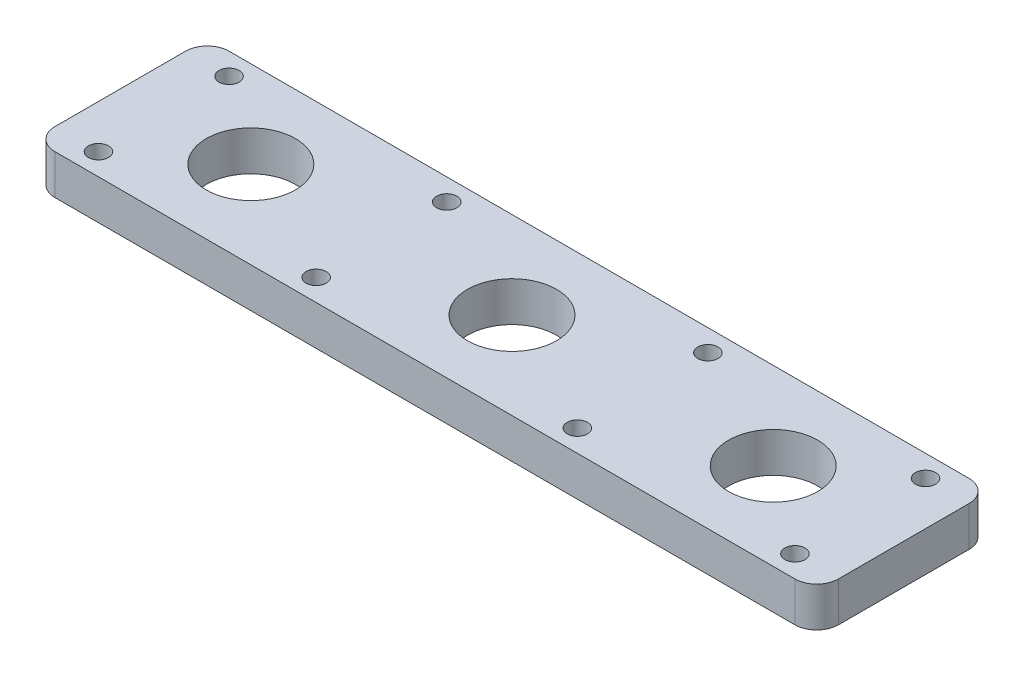
from build123d import *

# Parameters (mm, degrees)
SKETCH1_W             = 114.3
SKETCH1_H             = 25.4
SKETCH1_R             = 6.5
BOSS_EXTRUDE1_DEPTH   = 5.8
F_4_CLEARANCE_HOLE1_D = 2.9464
FILLET1_R             = 3.175


with BuildPart() as part:
    # Sketch1 → Boss-Extrude1 (new body)
    with BuildSketch(Plane(origin=(0, 0, 0), x_dir=(1, 0, 0), z_dir=(0, 1, 0))):
        with Locations((-57.15, 12.7)):
            Rectangle(SKETCH1_W, SKETCH1_H)
        with Locations(Location((-95.25, 12.7, 0), (0, 0, 270))):
            Circle(SKETCH1_R, mode=Mode.SUBTRACT)
        with Locations(Location((-57.15, 12.7, 0), (0, 0, 270))):
            Circle(SKETCH1_R, mode=Mode.SUBTRACT)
        with Locations(Location((-19.05, 12.7, 0), (0, 0, 270))):
            Circle(SKETCH1_R, mode=Mode.SUBTRACT)
    extrude(amount=BOSS_EXTRUDE1_DEPTH)

    # #4 Clearance Hole1 (through all)
    with Locations(Plane(origin=(0, 5.8, 0), x_dir=(-1, 0, 0), z_dir=(0, 1, 0))):
        with Locations((107.95, -22.225), (107.95, -3.175), (76.2, -22.225), (76.2, -3.175), (6.35, -22.225), (38.1, -22.225), (38.1, -3.175), (6.35, -3.175)):
            Hole(F_4_CLEARANCE_HOLE1_D / 2)

    # Fillet1
    fillet1_edges = [part.edges().sort_by_distance(p)[0] for p in [
        (0, 2.9, 0),
        (-114.3, 2.9, 0),
        (-114.3, 2.9, -25.4),
        (0, 2.9, -25.4),
    ]]
    fillet(fillet1_edges, radius=FILLET1_R)


solid = part.part
